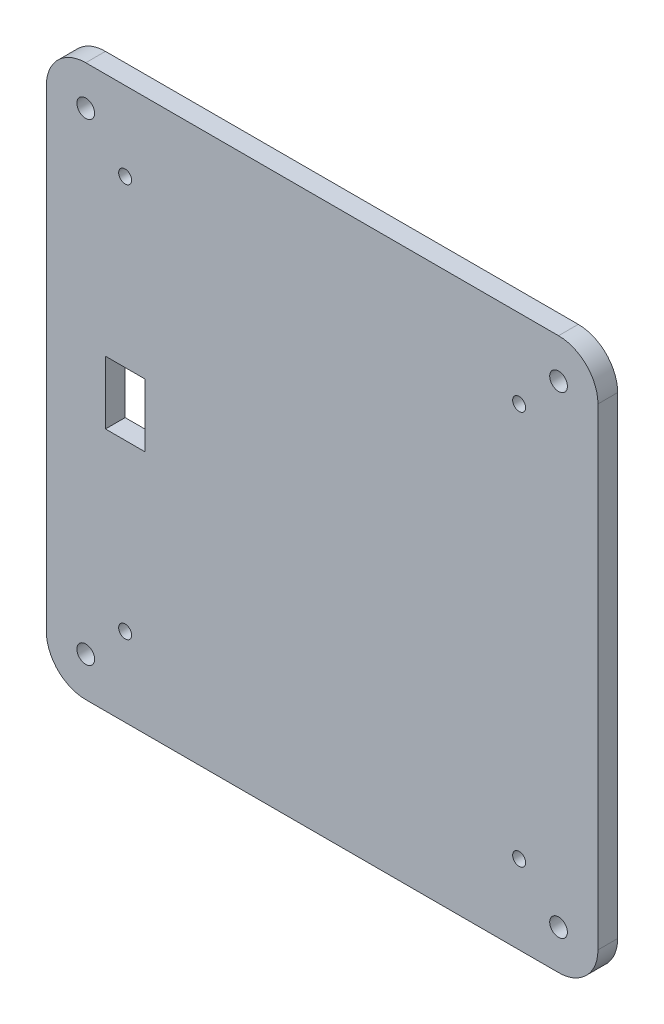
from build123d import *

# Parameters (mm, degrees)
ESKIZ_KONTUR_W        = 10
ESKIZ_KONTUR_H        = 16
PLASTINA_DEPTH        = 5
OTVERSTIYA_DEPTH      = 100.121138008
OTVERSTIYA_DEPTH_BACK = 100.121138008
ESKIZ_OTVERSTIYA_R    = 2.25
ESKIZ_OTVERSTIYA_R_2  = 1.65


with BuildPart() as part:
    # Eskiz_kontur → Plastina (new body)
    with BuildSketch(Plane.XY):
        with BuildLine():
            Line((-70, -60), (-70, 60))
            ThreePointArc((-70, 60), (-67.071067812, 67.071067812), (-60, 70))
            Line((-60, 70), (60, 70))
            ThreePointArc((60, 70), (67.071067812, 67.071067812), (70, 60))
            Line((70, 60), (70, -60))
            ThreePointArc((70, -60), (67.071067812, -67.071067812), (60, -70))
            Line((60, -70), (-60, -70))
            ThreePointArc((-60, -70), (-67.071067812, -67.071067812), (-70, -60))
        make_face()
        with Locations((-50, 0)):
            Rectangle(ESKIZ_KONTUR_W, ESKIZ_KONTUR_H, mode=Mode.SUBTRACT)
    extrude(amount=PLASTINA_DEPTH)

    # Eskiz_otverstiya → Otverstiya (cut, two sides: drawn at the far end of the back side and taken through both)
    with BuildSketch(Plane.XY.offset(-OTVERSTIYA_DEPTH_BACK)):
        with Locations((-60, -60)):
            Circle(ESKIZ_OTVERSTIYA_R)
        with Locations((-50, -50)):
            Circle(ESKIZ_OTVERSTIYA_R_2)
        with Locations((60, -60)):
            Circle(ESKIZ_OTVERSTIYA_R)
        with Locations((50, -50)):
            Circle(ESKIZ_OTVERSTIYA_R_2)
        with Locations((-50, 50)):
            Circle(ESKIZ_OTVERSTIYA_R_2)
        with Locations((-60, 60)):
            Circle(ESKIZ_OTVERSTIYA_R)
        with Locations((50, 50)):
            Circle(ESKIZ_OTVERSTIYA_R_2)
        with Locations((60, 60)):
            Circle(ESKIZ_OTVERSTIYA_R)
    extrude(amount=OTVERSTIYA_DEPTH + OTVERSTIYA_DEPTH_BACK, mode=Mode.SUBTRACT)


solid = part.part
